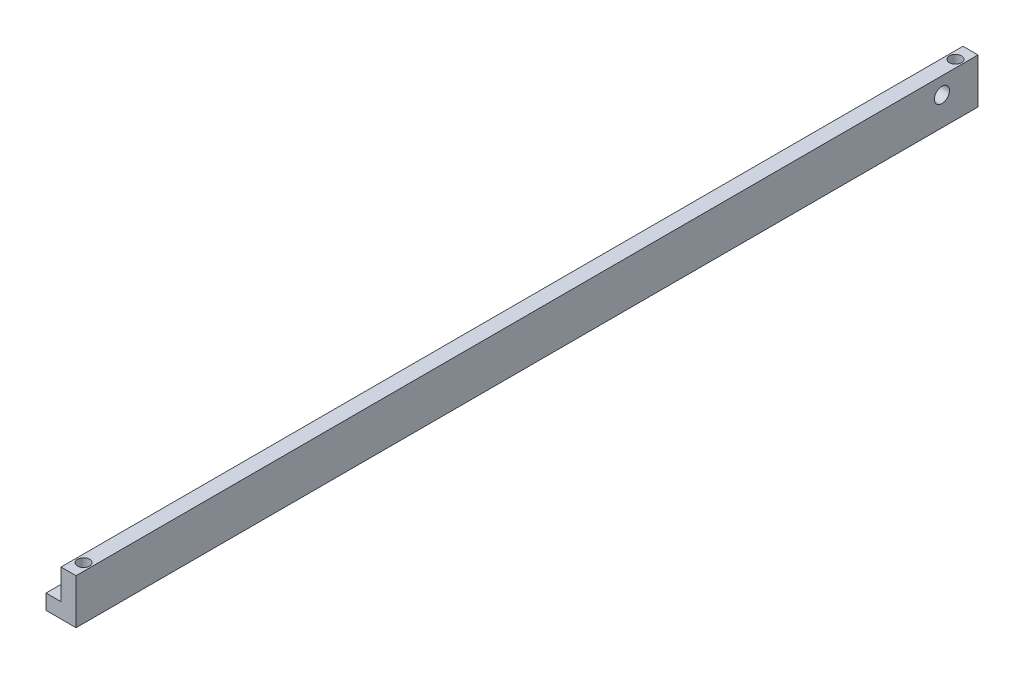
from build123d import *

# Parameters (mm, degrees)
SKETCH1_W           = 6.35
SKETCH1_H           = 19.05
BOSS_EXTRUDE1_DEPTH = 381
SKETCH1_3_W         = 6.35
SKETCH1_3_H         = 19.05
BOSS_EXTRUDE2_DEPTH = 25.4
SKETCH4_R           = 3.175000102
CUT_EXTRUDE3_DEPTH  = 25.4
SKETCH5_W           = 6.35
SKETCH5_H           = 6.35
BOSS_EXTRUDE3_DEPTH = 35.56
SKETCH2_R           = 2.54
CUT_EXTRUDE4_DEPTH  = 7.62
CUT_EXTRUDE5_START  = -7.62
SKETCH3_R           = 2.54
CUT_EXTRUDE5_DEPTH  = 7.62


with BuildPart() as part:
    # Sketch1 → Boss-Extrude1 (new body)
    with BuildSketch(Plane.XY):
        with Locations((-3.175, 9.525)):
            Rectangle(SKETCH1_W, SKETCH1_H)
    extrude(amount=BOSS_EXTRUDE1_DEPTH)

    # Sketch1<3> → Boss-Extrude2 (add)
    with BuildSketch(Plane.XY):
        with Locations((-3.175, 9.525)):
            Rectangle(SKETCH1_3_W, SKETCH1_3_H)
    extrude(amount=BOSS_EXTRUDE2_DEPTH)

    # Sketch4 → Cut-Extrude3 (cut)
    with BuildSketch(Plane(origin=(0, 0, 0), x_dir=(0, 0, -1), z_dir=(1, 0, 0))):
        with Locations((-15.24, 12.065)):
            Circle(SKETCH4_R)
    extrude(amount=-CUT_EXTRUDE3_DEPTH, mode=Mode.SUBTRACT)

    # Sketch5 → Boss-Extrude3 (add)
    with BuildSketch(Plane.XY.offset(381)):
        with Locations((-9.525, 3.175)):
            Rectangle(SKETCH5_W, SKETCH5_H)
    extrude(amount=-BOSS_EXTRUDE3_DEPTH)

    # Sketch2 → Cut-Extrude4 (cut)
    with BuildSketch(Plane(origin=(0, 19.05, 0), x_dir=(1, 0, 0), z_dir=(0, 1, 0))):
        with Locations((-3.175, -374.65)):
            Circle(SKETCH2_R)
        with Locations((-3.175, -6.35)):
            Circle(SKETCH2_R)
    extrude(amount=-CUT_EXTRUDE4_DEPTH, mode=Mode.SUBTRACT)

    # Sketch3 → Cut-Extrude5 (cut)
    with BuildSketch(Plane.XZ.offset(CUT_EXTRUDE5_START)):
        with Locations((-3.175, 374.65)):
            Circle(SKETCH3_R)
        with Locations((-3.175, 6.35)):
            Circle(SKETCH3_R)
    extrude(amount=CUT_EXTRUDE5_DEPTH, mode=Mode.SUBTRACT)


solid = part.part
